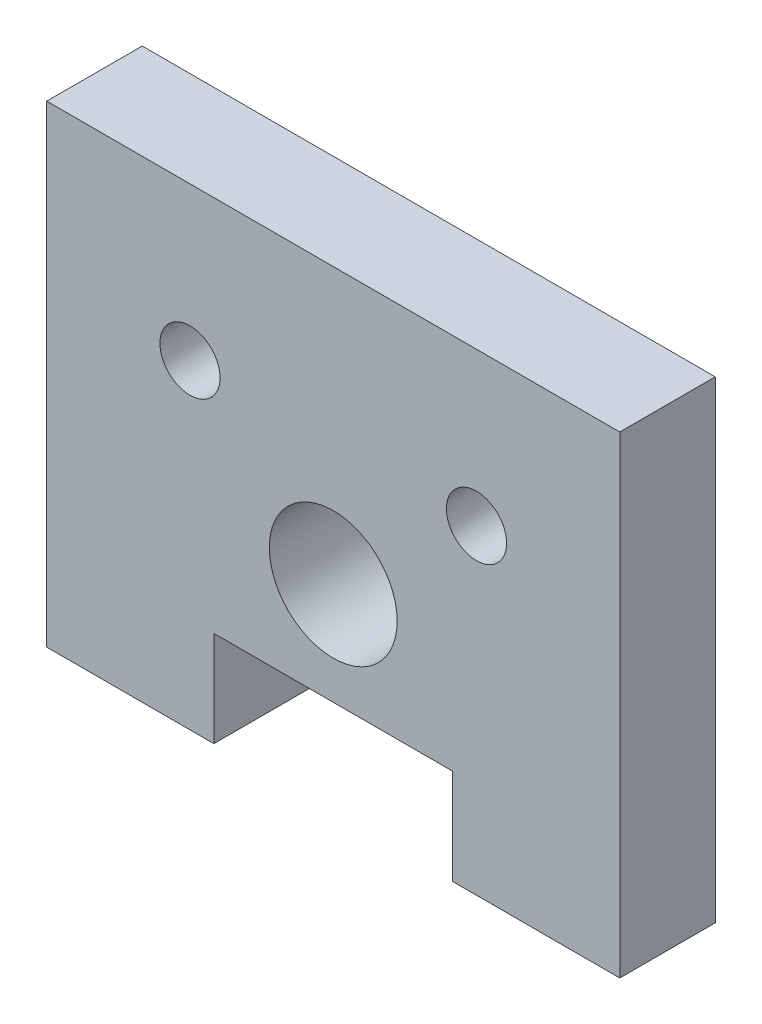
from build123d import *

# Parameters (mm, degrees)
SKETCH1_R           = 4
BOSS_EXTRUDE1_DEPTH = 12.7


with BuildPart() as part:
    # Sketch1 → Boss-Extrude1 (new body)
    with BuildSketch(Plane.XY):
        Polygon((-38.1, -34.544), (-15.875, -34.544), (-15.875, -21.844), (0, -21.844), (15.875, -21.844), (15.875, -34.544), (38.1, -34.544), (38.1, 28.336368082), (-19.05, 28.336368082), (-38.1, 28.336368082), align=None)
        with BuildLine():
            ThreePointArc((8.5, -8.264), (6.01040764, -14.27440764), (0, -16.764))
            ThreePointArc((0, -16.764), (-6.01040764, -2.25359236), (8.5, -8.264))
        make_face(mode=Mode.SUBTRACT)
        with Locations((-19.05, 7.992)):
            Circle(SKETCH1_R, mode=Mode.SUBTRACT)
        with Locations((19.05, 7.992)):
            Circle(SKETCH1_R, mode=Mode.SUBTRACT)
    extrude(amount=BOSS_EXTRUDE1_DEPTH)


solid = part.part
